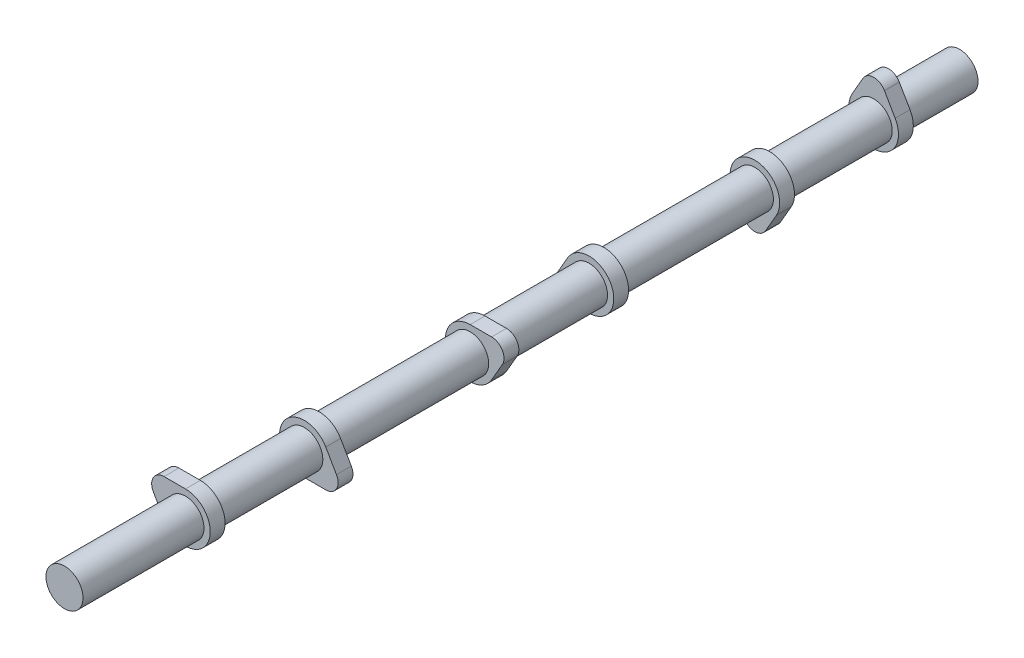
from build123d import *

# Parameters (mm, degrees)
BOSS_EXTRUDE1_DEPTH   = 3.81
BODY_MOVE_COPY2_ANGLE = 180
SKETCH2_R             = 9.5
BOSS_EXTRUDE2_DEPTH   = 146.05
LPATTERN1_COUNT       = 3
LPATTERN1_PITCH       = 146.05
BODY_MOVE_COPY3_ANGLE = 120
BODY_MOVE_COPY4_ANGLE = 120
BOSS_EXTRUDE3_START   = 27.94
SKETCH3_R             = 9.5
BOSS_EXTRUDE3_DEPTH   = 27.94
SKETCH4_R             = 9.5
CUT_EXTRUDE1_DEPTH    = 16.94
SKETCH5_R             = 9.5
BOSS_EXTRUDE4_DEPTH   = 10


with BuildPart() as part:
    # Sketch1 → Boss-Extrude1 (new, symmetric)
    with BuildSketch(Plane.XY):
        with BuildLine():
            Line((-5.499261314, 15.875), (-10.998522628, 6.35))
            ThreePointArc((-10.998522628, 6.35), (0, -12.7), (10.998522628, 6.35))
            Line((10.998522628, 6.35), (5.499261314, 15.875))
            ThreePointArc((5.499261314, 15.875), (0, 19.05), (-5.499261314, 15.875))
        make_face()
    extrude(amount=BOSS_EXTRUDE1_DEPTH, both=True)


with BuildPart() as body_2:
    # Body-Move/Copy1: copy of part
    add(part.part.moved(Location((0, 0, 60.96))))


with BuildPart() as body_2_1:
    # Body-Move/Copy2: moved
    add(body_2.part.rotate(Axis((0, 0, 0), (0, 0, 1)), BODY_MOVE_COPY2_ANGLE))


with BuildPart() as part_1:
    add(part.part)

    add(body_2_1.part)  # Boss-Extrude2 merges body 2
    # Sketch2 → Boss-Extrude2 (add)
    with BuildSketch(Plane(origin=(0, 0, -29.21), x_dir=(-1, 0, 0), z_dir=(0, 0, -1))):
        Circle(SKETCH2_R)
    extrude(amount=-BOSS_EXTRUDE2_DEPTH)


with BuildPart() as lpattern1_1:
    # LPattern1: pattern copy
    add(part_1.part.moved(Location(Vector(0, 0, 1) * (1 * LPATTERN1_PITCH))))


with BuildPart() as lpattern1_2:
    # LPattern1: pattern copy
    add(part_1.part.moved(Location(Vector(0, 0, 1) * (2 * LPATTERN1_PITCH))))


with BuildPart() as lpattern1_1_1:
    # Body-Move/Copy3: moved
    add(lpattern1_1.part.rotate(Axis((0, 0, 0), (0, 0, 1)), BODY_MOVE_COPY3_ANGLE))


with BuildPart() as lpattern1_2_1:
    # Body-Move/Copy4: moved
    add(lpattern1_2.part.rotate(Axis((0, 0, 0), (0, 0, -1)), BODY_MOVE_COPY4_ANGLE))


with BuildPart() as part_2:
    add(part_1.part)

    # Sketch3 → Boss-Extrude3 (add)
    with BuildSketch(Plane(origin=(0, 0, -29.21), x_dir=(-1, 0, 0), z_dir=(0, 0, -1)).offset(BOSS_EXTRUDE3_START)):
        Circle(SKETCH3_R)
    extrude(amount=-BOSS_EXTRUDE3_DEPTH)


with BuildPart() as lpattern1_2_2:
    add(lpattern1_2_1.part)

    # Combine1: union LPattern1_1, part
    add(lpattern1_1_1.part)
    add(part_2.part)

    # Sketch4 → Cut-Extrude1 (cut)
    with BuildSketch(Plane(origin=(0, 0, -57.15), x_dir=(-1, 0, 0), z_dir=(0, 0, -1))):
        Circle(SKETCH4_R)
    extrude(amount=-CUT_EXTRUDE1_DEPTH, mode=Mode.SUBTRACT)

    # Sketch5 → Boss-Extrude4 (add)
    with BuildSketch(Plane.XY.offset(408.94)):
        Circle(SKETCH5_R)
    extrude(amount=BOSS_EXTRUDE4_DEPTH)


solid = lpattern1_2_2.part
